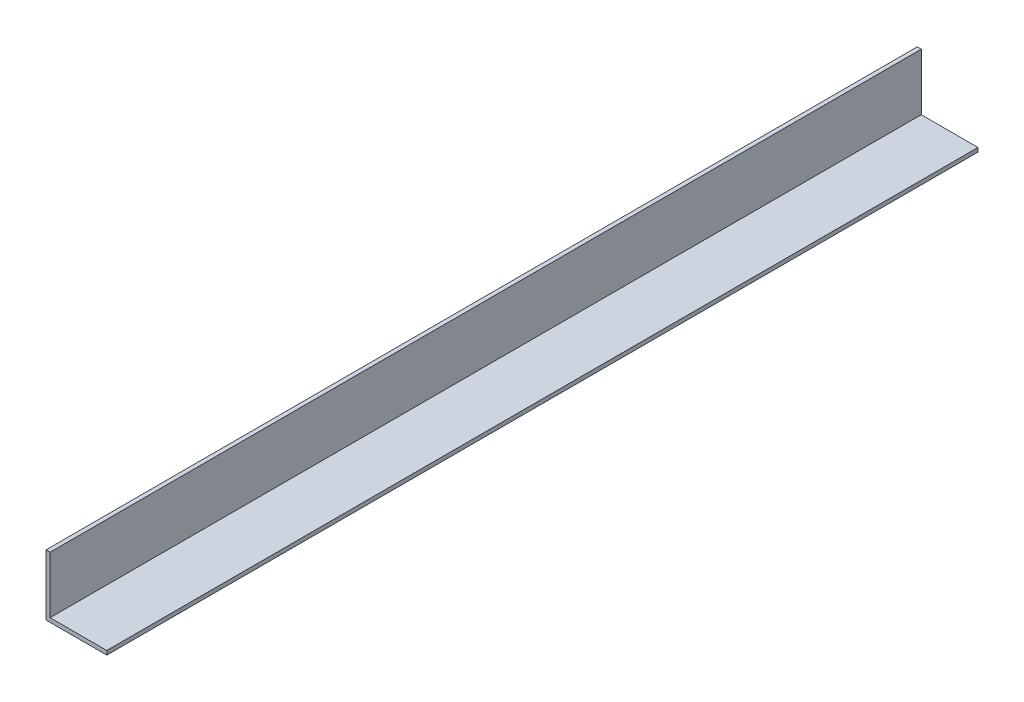
from build123d import *

# Parameters (mm, degrees)
BOSS_EXTRUDE1_DEPTH      = 410
BOSS_EXTRUDE1_DEPTH_BACK = 20


with BuildPart() as part:
    # Sketch1 → Boss-Extrude1 (new, two sides: drawn at the far end of the back side and taken through both)
    with BuildSketch(Plane.XY.offset(-BOSS_EXTRUDE1_DEPTH_BACK)):
        Polygon((0, 5.602318429), (0, 35.602318429), (2, 35.602318429), (2, 7.602318429), (30, 7.602318429), (30, 5.602318429), align=None)
    extrude(amount=BOSS_EXTRUDE1_DEPTH + BOSS_EXTRUDE1_DEPTH_BACK)


solid = part.part
